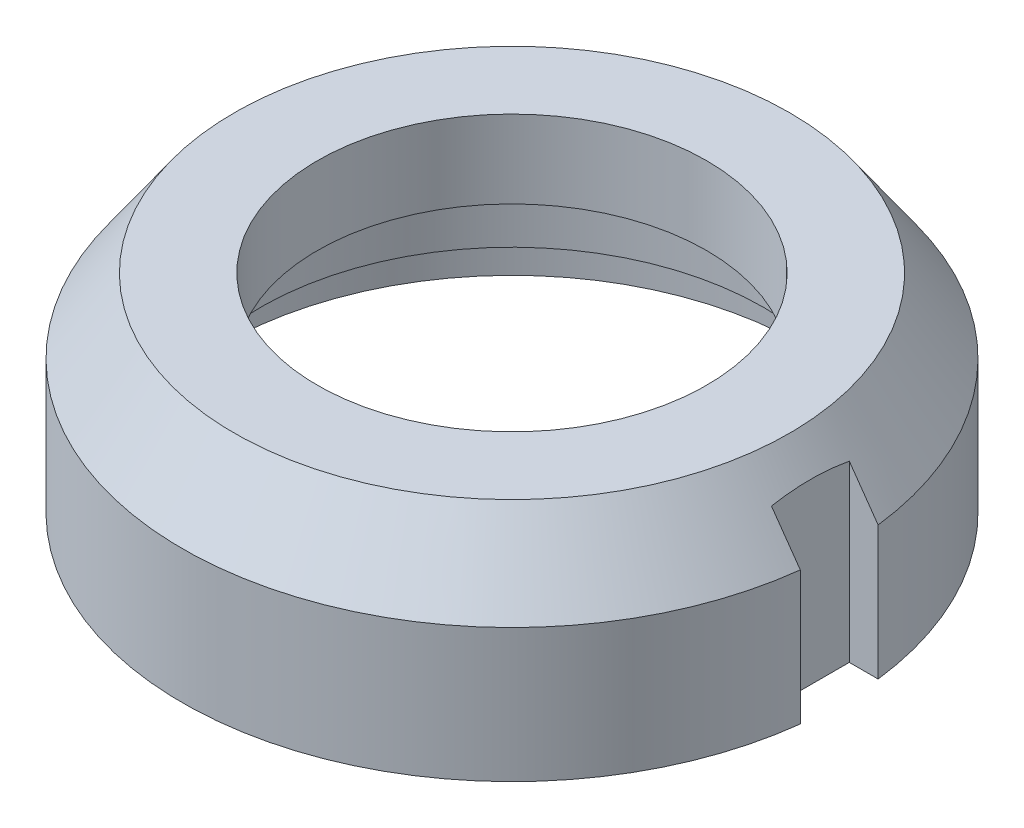
from build123d import *

# Parameters (mm, degrees)
SKETCH4_R          = 11.2
SKETCH4_R_2        = 9.7
CUT_EXTRUDE1_DEPTH = 2
CUT_EXTRUDE5_DEPTH = 20.661637775


with BuildPart() as part:
    # Sketch1 → Revolve1 (revolve)
    with BuildSketch(Plane.XY, mode=Mode.PRIVATE) as revolve1_sk:
        Polygon((-9.7, 0), (-9.7, -2), (-12.7, -2), (-12.7, 3.143703987), (-10.7, 6), (-7.5, 6), (-7.5, 3), (-9.7, 3), align=None)
    revolve(revolve1_sk.sketch.rotate(Axis((0, 0, 0), (0, 1, 0)), 270), axis=Axis((0, 0, 0), (0, 1, 0)))

    # Sketch4 → Cut-Extrude1 (cut)
    with BuildSketch(Plane.XZ.offset(2)):
        with Locations(Location((0, 0, 0), (0, 0, 270))):
            Circle(SKETCH4_R)
        with Locations(Location((0, 0, 0), (0, 0, 270))):
            Circle(SKETCH4_R_2, mode=Mode.SUBTRACT)
    extrude(amount=-CUT_EXTRUDE1_DEPTH, mode=Mode.SUBTRACT)

    # Sketch8 → Cut-Extrude5 (cut, through all)
    with BuildSketch(Plane(origin=(0, 6, 0), x_dir=(1, 0, 0), z_dir=(0, 1, 0))):
        with BuildLine():
            Line((-11.5, -1.5), (-11.5, 1.5))
            Line((-11.5, 1.5), (-12.611106216, 1.5))
            ThreePointArc((-12.611106216, 1.5), (-12.7, 0), (-12.611106216, -1.5))
            Line((-12.611106216, -1.5), (-11.5, -1.5))
        make_face()
        with BuildLine():
            Line((12.611106216, 1.5), (11.5, 1.5))
            Line((11.5, 1.5), (11.5, -1.5))
            Line((11.5, -1.5), (12.611106216, -1.5))
            ThreePointArc((12.611106216, -1.5), (12.677757076, -0.751315863), (12.7, 0))
            ThreePointArc((12.7, 0), (12.677757076, 0.751315863), (12.611106216, 1.5))
        make_face()
    extrude(amount=-CUT_EXTRUDE5_DEPTH, mode=Mode.SUBTRACT)


solid = part.part
